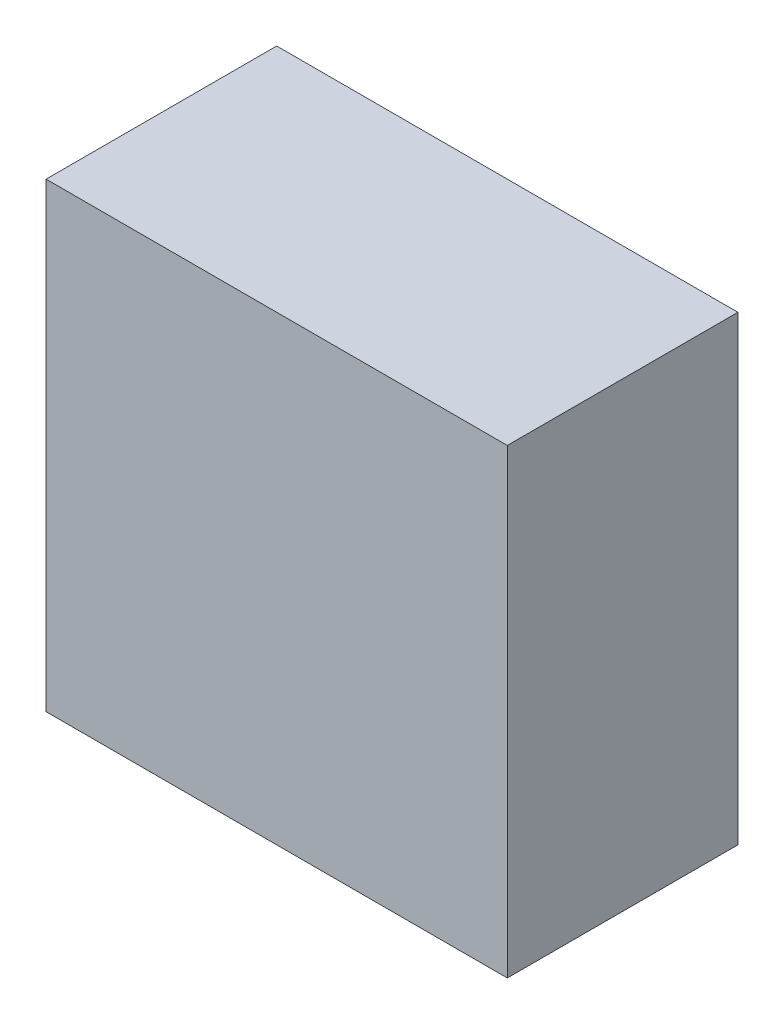
from build123d import *

# Parameters (mm, degrees)
BOSS_EXTRUDE1_DEPTH      = 10
BOSS_EXTRUDE1_DEPTH_BACK = 10
SKETCH1_W                = 40
SKETCH1_H                = 40
SKETCH2_W                = 10
SKETCH2_H                = 10
CUT_EXTRUDE1_DEPTH       = 5


with BuildPart() as part:
    # Sketch1 → Boss-Extrude1 (new, two sides: drawn at the far end of the back side and taken through both)
    with BuildSketch(Plane.XY.offset(-BOSS_EXTRUDE1_DEPTH_BACK)):
        with Locations((20, 20)):
            Rectangle(SKETCH1_W, SKETCH1_H)
    extrude(amount=BOSS_EXTRUDE1_DEPTH + BOSS_EXTRUDE1_DEPTH_BACK)

    # Sketch2 → Cut-Extrude1 (cut)
    with BuildSketch(Plane.XY):
        with Locations((5, 5)):
            Rectangle(SKETCH2_W, SKETCH2_H)
    extrude(amount=-CUT_EXTRUDE1_DEPTH, mode=Mode.SUBTRACT)


solid = part.part
